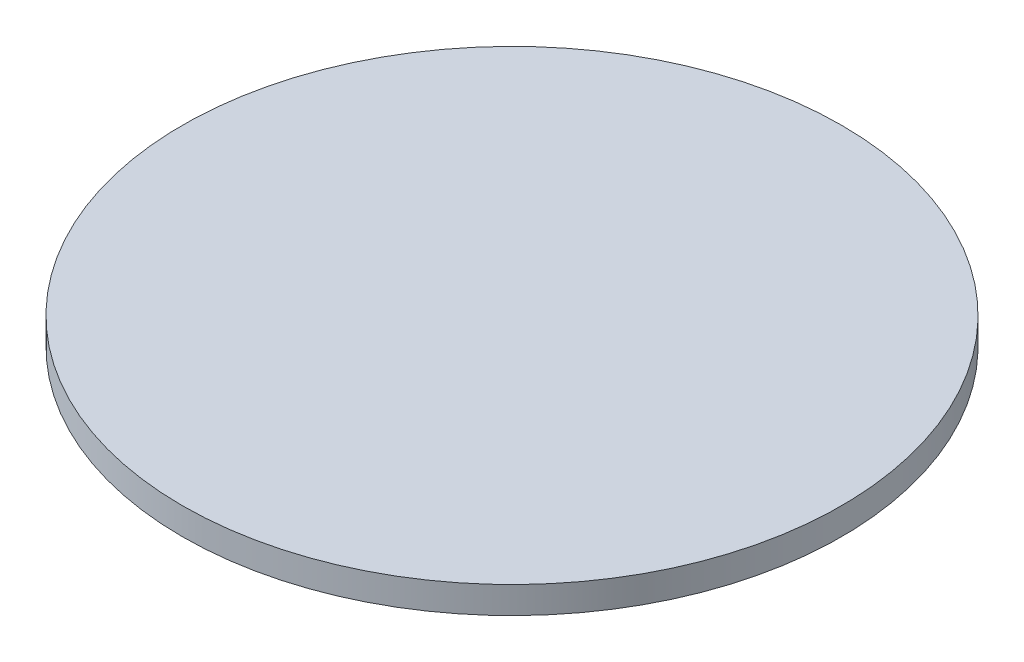
from build123d import *

# Parameters (mm, degrees)
SKETCH_1_R      = 49
EXTRUDE_1_DEPTH = 4


with BuildPart() as part:
    # Эскиз1 → Бобышка-Вытянуть1 (new body)
    with BuildSketch(Plane(origin=(0, 0, 0), x_dir=(1, 0, 0), z_dir=(0, 1, 0))):
        with Locations(Location((0, 0, 0), (0, 0, 270))):
            Circle(SKETCH_1_R)
    extrude(amount=EXTRUDE_1_DEPTH)


solid = part.part
